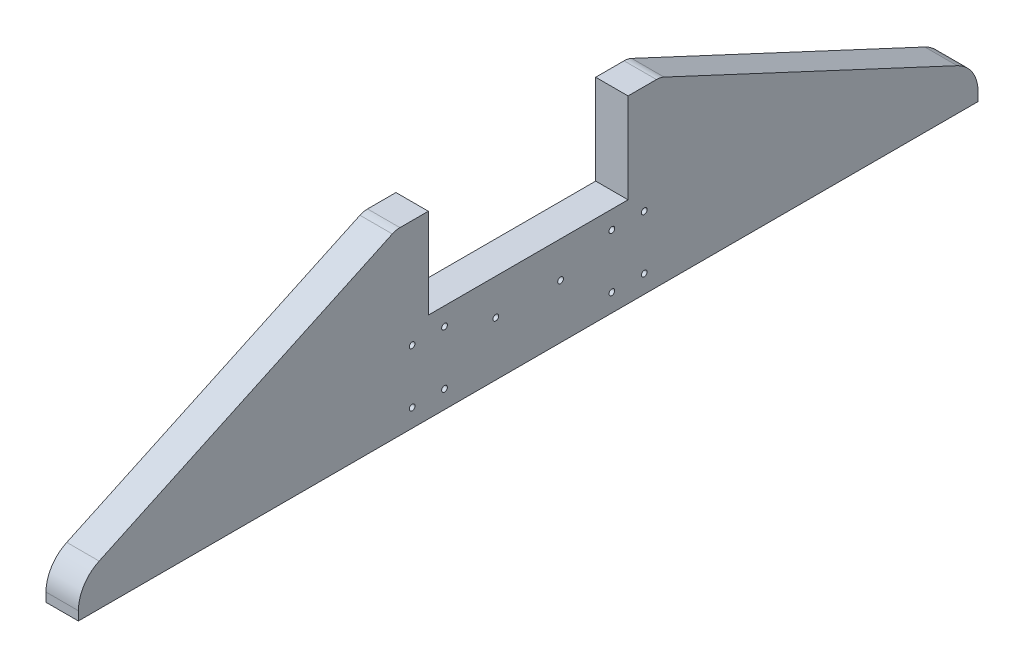
from build123d import *

# Parameters (mm, degrees)
SKETCH1_W                                  = 18
SKETCH1_H                                  = 100
BASE_DEPTH                                 = 500
SKETCH2_W                                  = 111
SKETCH2_H                                  = 50
LAP_JOINT_CUTOUT_DEPTH                     = 511.219560582
LAP_JOINT_BOLT_HOLE_PATTERN_D              = 3.175
CHAMFER_FRONT_SIZE                         = 176.5
CHAMFER_FRONT_SIZE2                        = 82.303301664
CHAMFER_REAR_SIZE                          = 176.5
CHAMFER_REAR_SIZE2                         = 82.303301664
BREAK_CHAMFER_OUTER_CORNERS_R              = 20
CROSS_TIE_BOLT_HOLE_PATTERN_D              = 3.175
FILLET1_R                                  = 10
FLOATING_BEARING_BLOCK_BOLT_HOLE_PATTERN_D = 3.175


with BuildPart() as part:
    # Sketch1 → base (new body)
    with BuildSketch(Plane.XY):
        with Locations((9, 50)):
            Rectangle(SKETCH1_W, SKETCH1_H)
    extrude(amount=BASE_DEPTH)

    # Sketch2 → lap joint cutout (cut, through all)
    with BuildSketch(Plane.ZY):
        with Locations((250, 75)):
            Rectangle(SKETCH2_W, SKETCH2_H)
    extrude(amount=-LAP_JOINT_CUTOUT_DEPTH, mode=Mode.SUBTRACT)

    # lap joint bolt hole pattern (through all)
    with Locations(Plane(origin=(18, 0, 0), x_dir=(0, 0, -1), z_dir=(1, 0, 0))):
        with Locations((-296.5, 40), (-203.5, 10), (-296.5, 10), (-203.5, 40)):
            Hole(LAP_JOINT_BOLT_HOLE_PATTERN_D / 2)

    # chamfer front
    chamfer_front_edges = [part.edges().sort_by_distance(p)[0] for p in [
        (9, 100, 0),
    ]]
    chamfer_front_side = [part.faces().sort_by_distance(p)[0] for p in [
        (9, 100, 97.25),
    ]]
    chamfer(chamfer_front_edges, length=CHAMFER_FRONT_SIZE, length2=CHAMFER_FRONT_SIZE2, reference=chamfer_front_side[0])

    # chamfer rear
    chamfer_rear_edges = [part.edges().sort_by_distance(p)[0] for p in [
        (9, 100, 500),
    ]]
    chamfer_rear_side = [part.faces().sort_by_distance(p)[0] for p in [
        (9, 100, 402.75),
    ]]
    chamfer(chamfer_rear_edges, length=CHAMFER_REAR_SIZE, length2=CHAMFER_REAR_SIZE2, reference=chamfer_rear_side[0])

    # break chamfer outer corners
    break_chamfer_outer_corners_edges = [part.edges().sort_by_distance(p)[0] for p in [
        (9, 17.696698336, 0),
        (9, 17.696698336, 500),
    ]]
    fillet(break_chamfer_outer_corners_edges, radius=BREAK_CHAMFER_OUTER_CORNERS_R)

    # cross tie bolt hole pattern (through all)
    with Locations(Plane(origin=(18, 0, 0), x_dir=(0, 0, -1), z_dir=(1, 0, 0))):
        with Locations((-314.5, 40), (-314.5, 10)):
            cross_tie_bolt_hole_pattern = Hole(CROSS_TIE_BOLT_HOLE_PATTERN_D / 2)

    # mirror cross tie bolt hole pattern: cross tie bolt hole pattern across plane
    add(cross_tie_bolt_hole_pattern.mirror(Plane(origin=(0, 0, 250), x_dir=(1, 0, 0), z_dir=(0, 0, -1))), mode=Mode.SUBTRACT)

    # Fillet1
    fillet1_edges = [part.edges().sort_by_distance(p)[0] for p in [
        (9, 100, 176.5),
        (9, 100, 323.5),
    ]]
    fillet(fillet1_edges, radius=FILLET1_R)

    # floating bearing block bolt hole pattern (through all)
    with Locations(Plane(origin=(18, 0, 0), x_dir=(0, 0, -1), z_dir=(1, 0, 0))):
        with Locations((-268, 30), (-232, 30)):
            Hole(FLOATING_BEARING_BLOCK_BOLT_HOLE_PATTERN_D / 2)


solid = part.part
